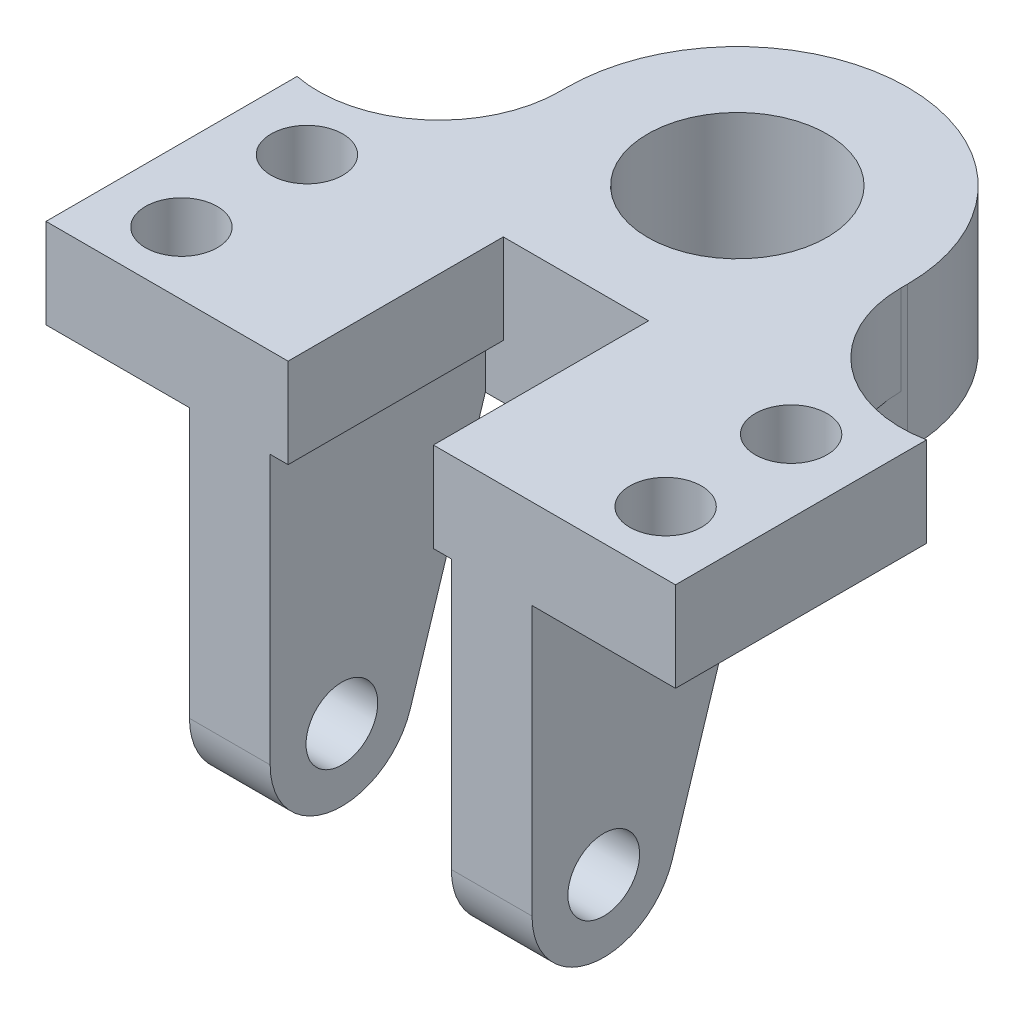
from build123d import *

# Parameters (mm, degrees)
SKETCH1_R           = 20
BOSS_EXTRUDE1_DEPTH = 32
SKETCH2_R           = 8
BOSS_EXTRUDE3_DEPTH = 20
BOSS_EXTRUDE4_START = -4
SKETCH11_R          = 8
BOSS_EXTRUDE4_DEPTH = 18


with BuildPart() as part:
    # Sketch1 → Boss-Extrude1 (new body)
    with BuildSketch(Plane(origin=(0, 0, 0), x_dir=(1, 0, 0), z_dir=(0, 1, 0))):
        with BuildLine():
            Line((-38, -36), (38, -36))
            Line((38, -36), (38, 0))
            ThreePointArc((38, 0), (0, 38), (-38, 0))
            Line((-38, 0), (-38, -36))
        make_face()
        with Locations(Location((0, 0, 0), (0, 0, 270))):
            Circle(SKETCH1_R, mode=Mode.SUBTRACT)
    extrude(amount=BOSS_EXTRUDE1_DEPTH)

    # Sketch2 → Boss-Extrude3 (add)
    with BuildSketch(Plane(origin=(0, 32, 0), x_dir=(1, 0, 0), z_dir=(0, 1, 0))):
        with BuildLine():
            Line((-16.20578503, -84), (-38.20578503, -84))
            Line((-38.20578503, -84), (-70.20578503, -84))
            Line((-70.20578503, -84), (-70.20578503, -28))
            ThreePointArc((-70.20578503, -28), (-47.848139938, -22.366161341), (-38, -1.518653771))
            Line((-38, -1.518653771), (-38, -36))
            Line((-38, -36), (-16.20578503, -36))
            Line((-16.20578503, -36), (-16.20578503, -84))
        make_face()
        with Locations(Location((-54, -42, 0), (0, 0, 270))):
            Circle(SKETCH2_R, mode=Mode.SUBTRACT)
        with Locations(Location((-54, -70, 0), (0, 0, 270))):
            Circle(SKETCH2_R, mode=Mode.SUBTRACT)
    boss_extrude3 = extrude(amount=-BOSS_EXTRUDE3_DEPTH)

    # Mirror1: Boss-Extrude3 across plane
    add(boss_extrude3.mirror(Plane(origin=(0, 0, 0), x_dir=(0, 0, 1), z_dir=(1, 0, 0))))

    # Sketch11 → Boss-Extrude4 (add)
    with BuildSketch(Plane.ZY.offset(-16.20578503).offset(BOSS_EXTRUDE4_START)):
        with BuildLine():
            Line((36, 12), (84, 12))
            Line((84, 12), (84, -48))
            ThreePointArc((84, -48), (70.446111196, -63.811911333), (52.747932498, -52.834711668))
            Line((52.747932498, -52.834711668), (36, 0))
            Line((36, 0), (36, 12))
        make_face()
        with Locations((68, -48)):
            Circle(SKETCH11_R, mode=Mode.SUBTRACT)
    boss_extrude4 = extrude(amount=-BOSS_EXTRUDE4_DEPTH)

    # Mirror2: Boss-Extrude4 across plane
    add(boss_extrude4.mirror(Plane(origin=(0, 0, 0), x_dir=(0, 0, 1), z_dir=(1, 0, 0))))


solid = part.part
